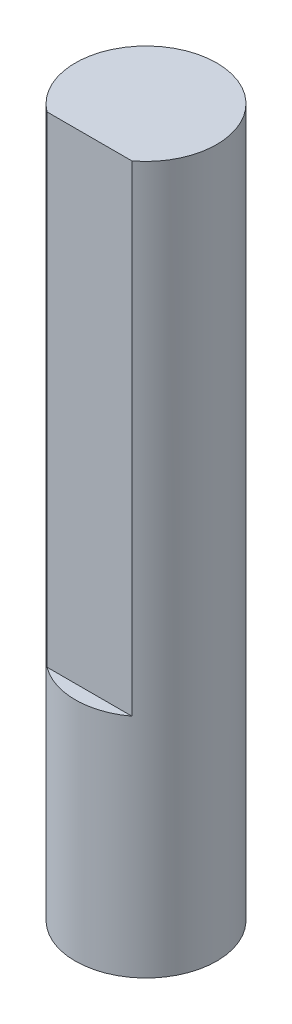
from build123d import *

# Parameters (mm, degrees)
SKETCH_1_R          = 2.5
EXTRUDE_1_DEPTH     = 25
CUT_EXTRUDE_START   = -17
CUT_EXTRUDE_1_DEPTH = 17


with BuildPart() as part:
    # Эскиз1 → Бобышка-Вытянуть1 (new body)
    with BuildSketch(Plane(origin=(0, 0, 0), x_dir=(1, 0, 0), z_dir=(0, 1, 0))):
        with Locations(Location((0, 0, 0), (0, 0, 270))):
            Circle(SKETCH_1_R)
    extrude(amount=EXTRUDE_1_DEPTH)

    # Эскиз2 → Вырез-Вытянуть1 (cut)
    with BuildSketch(Plane(origin=(0, 25, 0), x_dir=(1, 0, 0), z_dir=(0, 1, 0)).offset(CUT_EXTRUDE_START)):
        with BuildLine():
            Line((1.5, -2), (-1.5, -2))
            ThreePointArc((-1.5, -2), (0, -2.5), (1.5, -2))
        make_face()
    extrude(amount=CUT_EXTRUDE_1_DEPTH, mode=Mode.SUBTRACT)


solid = part.part
